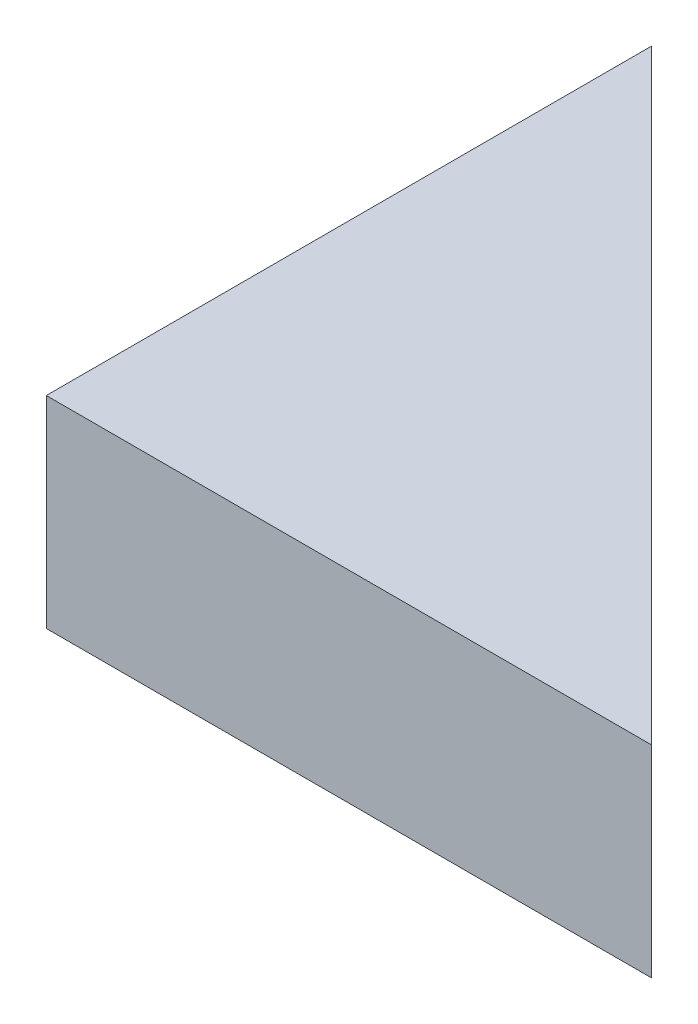
from build123d import *

# Parameters (mm, degrees)
BOSS_EXTRUDE1_DEPTH = 12.7


with BuildPart() as part:
    # Sketch1 → Boss-Extrude1 (new body)
    with BuildSketch(Plane(origin=(0, 0, 0), x_dir=(1, 0, 0), z_dir=(0, 1, 0))):
        Polygon((57.393386489, -1069.20385267), (19.293386489, -1069.20385267), (19.293386489, -1031.10385267), align=None)
    extrude(amount=-BOSS_EXTRUDE1_DEPTH)


solid = part.part
